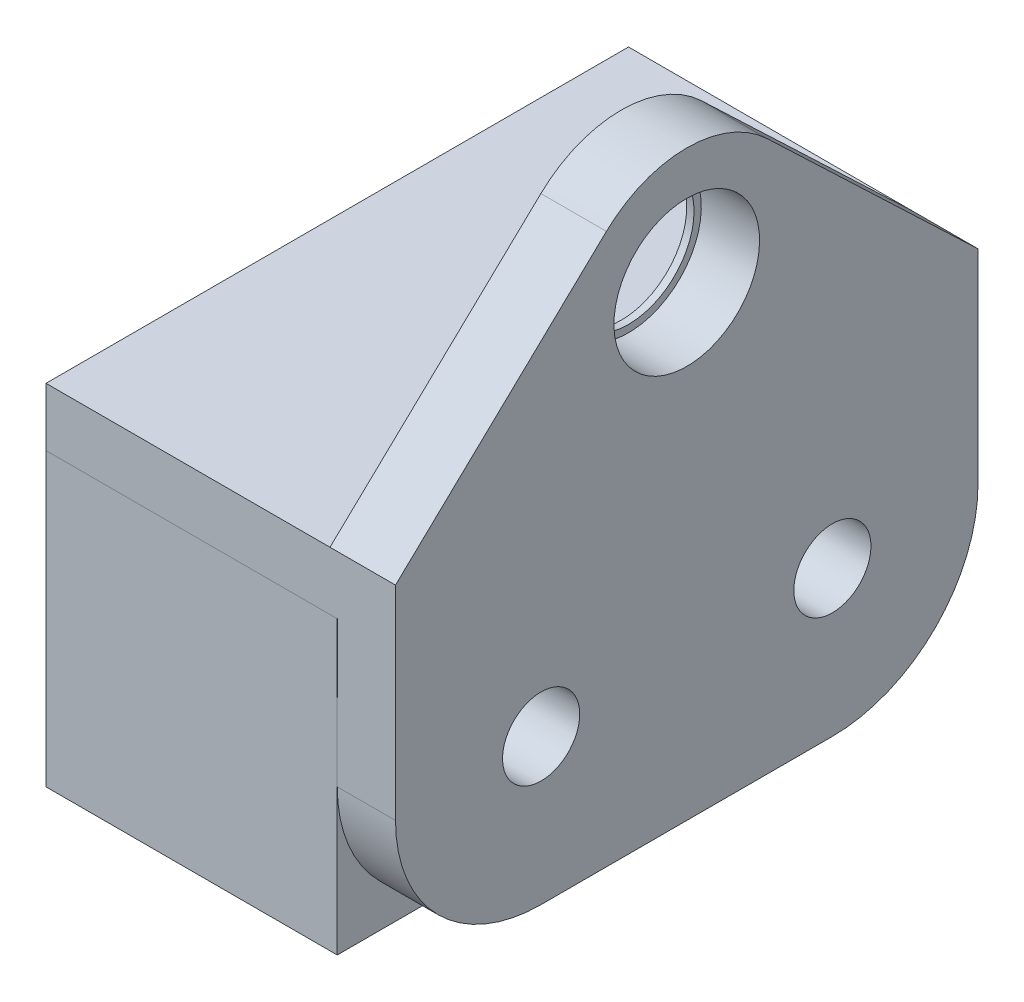
from build123d import *

# Parameters (mm, degrees)
SKETCH_2_W                 = 20
SKETCH_2_H                 = 20
EXTRUDE_1_DEPTH            = 20
SKETCH_3_W                 = 40
SKETCH_3_H                 = 24
EXTRUDE_2_DEPTH            = 4
SKETCH_5_W                 = 2.65
SKETCH_5_H                 = 24
HOLE_WIZARD_M51_AT_2_COUNT = 2
HOLE_WIZARD_M51_AT_2_PITCH = 20
SKETCH_6_W                 = 40
SKETCH_6_H                 = 4
EXTRUDE_3_DEPTH            = 20
SKETCH_7_W                 = 6.1
SKETCH_7_H                 = 8
EXTRUDE_4_DEPTH            = 3
CHAMFER_1_SIZE             = 1
SKETCH_8_R                 = 5
EXTRUDE_5_DEPTH            = 4.5
SKETCH_9_R                 = 5
SKETCH_9_R_2               = 4.5
EXTRUDE_6_DEPTH            = 0.5
FILLET_1_R                 = 10


with BuildPart() as part:
    # Эскиз2 → Бобышка-Вытянуть1 (new, symmetric)
    with BuildSketch(Plane.XY):
        Rectangle(SKETCH_2_W, SKETCH_2_H)
    extrude(amount=EXTRUDE_1_DEPTH, both=True)


with BuildPart() as body_2:
    # Эскиз3 → Бобышка-Вытянуть2 (new body)
    with BuildSketch(Plane(origin=(10, 0, 0), x_dir=(0, 0, -1), z_dir=(1, 0, 0))):
        with Locations((0, 2)):
            Rectangle(SKETCH_3_W, SKETCH_3_H)
    extrude(amount=EXTRUDE_2_DEPTH)

    # Эскиз5 → Отверстие с зазором M51 (revolve, cut)
    with BuildSketch(Plane(origin=(14, 0, 10), x_dir=(0, 0, -1), z_dir=(0, 1, 0))):
        with Locations((1.325, 12)):
            Rectangle(SKETCH_5_W, SKETCH_5_H)
    hole_wizard_m51 = revolve(axis=Axis((20.35, 0, 10), (-1, 0, 0)), mode=Mode.SUBTRACT)

    # Отверстие с зазором M51 at 2: Отверстие с зазором M51 ×2
    with Locations(*[(0, 0, -i * HOLE_WIZARD_M51_AT_2_PITCH) for i in range(1, HOLE_WIZARD_M51_AT_2_COUNT)]):
        add(hole_wizard_m51, mode=Mode.SUBTRACT)

    # Эскиз6 → Бобышка-Вытянуть3 (add)
    with BuildSketch(Plane.ZY.offset(-10)):
        with Locations((0, 12)):
            Rectangle(SKETCH_6_W, SKETCH_6_H)
    extrude(amount=EXTRUDE_3_DEPTH)

    # Эскиз7 → Бобышка-Вытянуть4 (add)
    with BuildSketch(Plane.XZ.offset(-10)):
        with Locations((0, 12)):
            Rectangle(SKETCH_7_W, SKETCH_7_H)
        with Locations((0, -12)):
            Rectangle(SKETCH_7_W, SKETCH_7_H)
    extrude(amount=EXTRUDE_4_DEPTH)

    # Фаска1
    chamfer_1_edges = [body_2.edges().sort_by_distance(p)[0] for p in [
        (-3.05, 7, 12),
        (3.05, 7, 12),
        (-3.05, 7, -12),
        (3.05, 7, -12),
    ]]
    chamfer(chamfer_1_edges, length=CHAMFER_1_SIZE)

    # Эскиз8 → Бобышка-Вытянуть5 (add)
    with BuildSketch(Plane(origin=(14, 0, 0), x_dir=(0, 0, -1), z_dir=(1, 0, 0))):
        with BuildLine():
            ThreePointArc((-5.517241379, 27.793103448), (0, 30), (5.517241379, 27.793103448))
            Line((5.517241379, 27.793103448), (20, 14))
            Line((20, 14), (-20, 14))
            Line((-20, 14), (-5.517241379, 27.793103448))
        make_face()
        with Locations(Location((0, 22, 0), (0, 0, 90))):
            Circle(SKETCH_8_R, mode=Mode.SUBTRACT)
    extrude(amount=-EXTRUDE_5_DEPTH)

    # Эскиз9 → Бобышка-Вытянуть6 (add)
    with BuildSketch(Plane.ZY.offset(-9.5)):
        with Locations(Location((0, 22, 0), (0, 0, 90))):
            Circle(SKETCH_9_R)
        with Locations(Location((0, 22, 0), (0, 0, 270))):
            Circle(SKETCH_9_R_2, mode=Mode.SUBTRACT)
    extrude(amount=-EXTRUDE_6_DEPTH)

    # Скругление1
    fillet_1_edges = [body_2.edges().sort_by_distance(p)[0] for p in [
        (12, -10, -20),
        (12, -10, 20),
    ]]
    fillet(fillet_1_edges, radius=FILLET_1_R)


solid = Compound([part.part, body_2.part])
